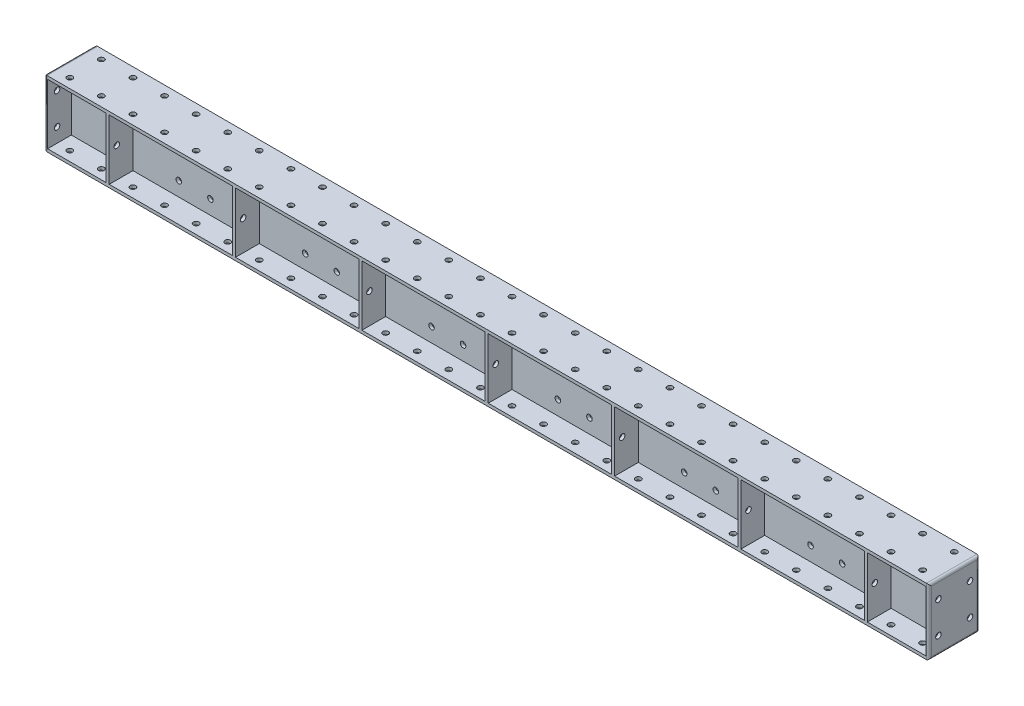
from build123d import *

# Parameters (mm, degrees)
SKETCH_1_W                         = 3500
SKETCH_1_H                         = 262
EXTRUDE_1_DEPTH                    = 200
SKETCH_5_W                         = 232
SKETCH_5_H                         = 238
SKETCH_5_W_2                       = 488
CUT_EXTRUDE_10_DEPTH               = 3516.486310598
SKETCH_7_W                         = 3500
SKETCH_7_H                         = 12
EXTRUDE_13_DEPTH                   = 260
SKETCH_8_R                         = 11
CUT_EXTRUDE_14_DEPTH               = 3516.486310598
PATTERN_LINEAR_3_COUNT             = 28
PATTERN_LINEAR_3_PITCH             = 125
PATTERN_LINEAR_3_COUNT_DIR2        = 2
PATTERN_LINEAR_3_PITCH_DIR2        = 125
SKETCH_10_R                        = 11
CUT_EXTRUDE_16_DEPTH               = 20
PATTERN_LINEAR_5_COUNT             = 2
PATTERN_LINEAR_5_PITCH             = 125
PATTERN_LINEAR_5_COUNT_DIR2        = 2
PATTERN_LINEAR_5_PITCH_DIR2        = 125
CUT_EXTRUDE_START                  = -20
SKETCH_11_R                        = 11
CUT_EXTRUDE_17_DEPTH               = 20
PATTERN_LINEAR_6_COUNT             = 2
PATTERN_LINEAR_6_PITCH             = 125
PATTERN_LINEAR_6_COUNT_DIR2        = 2
PATTERN_LINEAR_6_PITCH_DIR2        = 125
SKETCH_12_R                        = 11
CUT_EXTRUDE_18_DEPTH               = 3020
PATTERN_LINEAR_8_COUNT             = 2
PATTERN_LINEAR_8_PITCH             = 140.2426687
FILLET_1_R                         = 10
FILLET_2_R                         = 10
SKETCH_13_R                        = 11
CUT_EXTRUDE_19_DEPTH               = 3512.392886021
PATTERN_LINEAR_9_COUNT             = 2
PATTERN_LINEAR_9_PITCH             = 125
PATTERN_LINEAR_9_COUNT_DIR2        = 2
PATTERN_LINEAR_9_PITCH_DIR2        = 125
PATTERN_LINEAR_10_COUNT            = 6
PATTERN_LINEAR_10_PITCH            = 500
PATTERN_LINEAR_10_COPY_1_SKETCH_R  = 11
PATTERN_LINEAR_10_COPY_1_DEPTH     = 3512.392886021
PATTERN_LINEAR_10_COPY_2_SKETCH_R  = 11
PATTERN_LINEAR_10_COPY_2_DEPTH     = 3512.392886021
PATTERN_LINEAR_10_COPY_3_SKETCH_R  = 11
PATTERN_LINEAR_10_COPY_3_DEPTH     = 3512.392886021
PATTERN_LINEAR_10_COPY_4_SKETCH_R  = 11
PATTERN_LINEAR_10_COPY_4_DEPTH     = 3512.392886021
PATTERN_LINEAR_10_COPY_5_SKETCH_R  = 11
PATTERN_LINEAR_10_COPY_5_DEPTH     = 3512.392886021
PATTERN_LINEAR_10_COPY_6_SKETCH_R  = 11
PATTERN_LINEAR_10_COPY_6_DEPTH     = 3512.392886021
PATTERN_LINEAR_10_COPY_7_SKETCH_R  = 11
PATTERN_LINEAR_10_COPY_7_DEPTH     = 3512.392886021
PATTERN_LINEAR_10_COPY_8_SKETCH_R  = 11
PATTERN_LINEAR_10_COPY_8_DEPTH     = 3512.392886021
PATTERN_LINEAR_10_COPY_9_SKETCH_R  = 11
PATTERN_LINEAR_10_COPY_9_DEPTH     = 3512.392886021
PATTERN_LINEAR_10_COPY_10_SKETCH_R = 11
PATTERN_LINEAR_10_COPY_10_DEPTH    = 3512.392886021
PATTERN_LINEAR_10_COPY_11_SKETCH_R = 11
PATTERN_LINEAR_10_COPY_11_DEPTH    = 3512.392886021
PATTERN_LINEAR_10_COPY_12_SKETCH_R = 11
PATTERN_LINEAR_10_COPY_12_DEPTH    = 3512.392886021
PATTERN_LINEAR_10_COPY_13_SKETCH_R = 11
PATTERN_LINEAR_10_COPY_13_DEPTH    = 3512.392886021
PATTERN_LINEAR_10_COPY_14_SKETCH_R = 11
PATTERN_LINEAR_10_COPY_14_DEPTH    = 3512.392886021
PATTERN_LINEAR_10_COPY_15_SKETCH_R = 11
PATTERN_LINEAR_10_COPY_15_DEPTH    = 3512.392886021


with BuildPart() as part:
    # 草图1 → 拉伸1 (new body)
    with BuildSketch(Plane.XY):
        with Locations((1750, 131)):
            Rectangle(SKETCH_1_W, SKETCH_1_H)
    extrude(amount=EXTRUDE_1_DEPTH)

    # 草图5 → 拉伸10 (cut, through all)
    with BuildSketch(Plane.XY.offset(200)):
        with Locations((128, 131)):
            Rectangle(SKETCH_5_W, SKETCH_5_H)
        with Locations((500, 131)):
            Rectangle(SKETCH_5_W_2, SKETCH_5_H)
        with Locations((1000, 131)):
            Rectangle(SKETCH_5_W_2, SKETCH_5_H)
        with Locations((1500, 131)):
            Rectangle(SKETCH_5_W_2, SKETCH_5_H)
        with Locations((2000, 131)):
            Rectangle(SKETCH_5_W_2, SKETCH_5_H)
        with Locations((2500, 131)):
            Rectangle(SKETCH_5_W_2, SKETCH_5_H)
        with Locations((3000, 131)):
            Rectangle(SKETCH_5_W_2, SKETCH_5_H)
        with Locations((3372, 131)):
            Rectangle(SKETCH_5_W, SKETCH_5_H)
    extrude(amount=-CUT_EXTRUDE_10_DEPTH, mode=Mode.SUBTRACT)

    # 草图7 → 拉伸13 (add)
    with BuildSketch(Plane.XZ):
        with Locations((1750, 100)):
            Rectangle(SKETCH_7_W, SKETCH_7_H)
    extrude(amount=-EXTRUDE_13_DEPTH)

    # 草图8 → 拉伸14 (cut, through all)
    with BuildSketch(Plane.XZ):
        with Locations(Location((62.5, 37.5, 0), (0, 0, 270))):
            Circle(SKETCH_8_R)
    cut_extrude_14 = extrude(amount=-CUT_EXTRUDE_14_DEPTH, mode=Mode.SUBTRACT)

    # 阵列(线性)3: Cut-Extrude 14 28 × 2
    with Locations(*[(i * PATTERN_LINEAR_3_PITCH, 0, j * PATTERN_LINEAR_3_PITCH_DIR2) for i in range(PATTERN_LINEAR_3_COUNT) for j in range(PATTERN_LINEAR_3_COUNT_DIR2) if (i, j) != (0, 0)]):
        add(cut_extrude_14, mode=Mode.SUBTRACT)

    # 草图10 → 拉伸16 (cut)
    with BuildSketch(Plane.ZY):
        with Locations((37.5, 68.5)):
            Circle(SKETCH_10_R)
    cut_extrude_16 = extrude(amount=-CUT_EXTRUDE_16_DEPTH, mode=Mode.SUBTRACT)

    # 阵列(线性)5: Cut-Extrude 16 2 × 2
    with Locations(*[(0, j * PATTERN_LINEAR_5_PITCH_DIR2, i * PATTERN_LINEAR_5_PITCH) for i in range(PATTERN_LINEAR_5_COUNT) for j in range(PATTERN_LINEAR_5_COUNT_DIR2) if (i, j) != (0, 0)]):
        add(cut_extrude_16, mode=Mode.SUBTRACT)

    # 草图11 → 拉伸17 (cut)
    with BuildSketch(Plane(origin=(3500, 0, 0), x_dir=(0, 0, -1), z_dir=(1, 0, 0)).offset(CUT_EXTRUDE_START)):
        with Locations(Location((-162.5, 68.5, 0), (0, 0, 180))):
            Circle(SKETCH_11_R)
    cut_extrude_17 = extrude(amount=CUT_EXTRUDE_17_DEPTH, mode=Mode.SUBTRACT)

    # 阵列(线性)6: Cut-Extrude 17 2 × 2
    with Locations(*[(0, j * PATTERN_LINEAR_6_PITCH_DIR2, -i * PATTERN_LINEAR_6_PITCH) for i in range(PATTERN_LINEAR_6_COUNT) for j in range(PATTERN_LINEAR_6_COUNT_DIR2) if (i, j) != (0, 0)]):
        add(cut_extrude_17, mode=Mode.SUBTRACT)

    # 草图12 → 拉伸18 (cut)
    with BuildSketch(Plane(origin=(3256, 0, 0), x_dir=(0, 0, -1), z_dir=(1, 0, 0))):
        with Locations((-170.12133435, 131)):
            Circle(SKETCH_12_R)
    cut_extrude_18 = extrude(amount=-CUT_EXTRUDE_18_DEPTH, mode=Mode.SUBTRACT)

    # 阵列(线性)8: 拉伸18 ×2
    with Locations(*[(0, 0, -i * PATTERN_LINEAR_8_PITCH) for i in range(1, PATTERN_LINEAR_8_COUNT)]):
        add(cut_extrude_18, mode=Mode.SUBTRACT)

    # 圆角1
    fillet_1_edges = [part.edges().sort_by_distance(p)[0] for p in [
        (0, 131, 200),
        (0, 131, 0),
        (0, 262, 100),
        (0, 0, 100),
    ]]
    fillet(fillet_1_edges, radius=FILLET_1_R)

    # 圆角2
    fillet_2_edges = [part.edges().sort_by_distance(p)[0] for p in [
        (3500, 131, 200),
        (3500, 131, 0),
        (3500, 262, 100),
        (3500, 0, 100),
    ]]
    fillet(fillet_2_edges, radius=FILLET_2_R)

    # 草图13 → 拉伸19 (cut, through all)
    with BuildSketch(Plane.XY.offset(106)):
        with Locations((437.5, 68.5)):
            Circle(SKETCH_13_R)
    cut_extrude_19 = extrude(amount=-CUT_EXTRUDE_19_DEPTH, mode=Mode.SUBTRACT)

    # 阵列(线性)9: Cut-Extrude 19 2 × 2
    with Locations(*[(i * PATTERN_LINEAR_9_PITCH, j * PATTERN_LINEAR_9_PITCH_DIR2, 0) for i in range(PATTERN_LINEAR_9_COUNT) for j in range(PATTERN_LINEAR_9_COUNT_DIR2) if (i, j) != (0, 0)]):
        add(cut_extrude_19, mode=Mode.SUBTRACT)

    # 阵列(线性)10: 拉伸19 ×6
    with Locations(*[(i * PATTERN_LINEAR_10_PITCH, 0, 0) for i in range(1, PATTERN_LINEAR_10_COUNT)]):
        add(cut_extrude_19, mode=Mode.SUBTRACT)

    # 阵列(线性)10 copy 1 sketch → 阵列(线性)10 copy 1 (cut, through all)
    with BuildSketch(Plane(origin=(500, 125, 106), x_dir=(1, 0, 0), z_dir=(0, 0, 1))):
        with Locations((437.5, 68.5)):
            Circle(PATTERN_LINEAR_10_COPY_1_SKETCH_R)
    extrude(amount=-PATTERN_LINEAR_10_COPY_1_DEPTH, mode=Mode.SUBTRACT)

    # 阵列(线性)10 copy 2 sketch → 阵列(线性)10 copy 2 (cut, through all)
    with BuildSketch(Plane(origin=(1000, 125, 106), x_dir=(1, 0, 0), z_dir=(0, 0, 1))):
        with Locations((437.5, 68.5)):
            Circle(PATTERN_LINEAR_10_COPY_2_SKETCH_R)
    extrude(amount=-PATTERN_LINEAR_10_COPY_2_DEPTH, mode=Mode.SUBTRACT)

    # 阵列(线性)10 copy 3 sketch → 阵列(线性)10 copy 3 (cut, through all)
    with BuildSketch(Plane(origin=(1500, 125, 106), x_dir=(1, 0, 0), z_dir=(0, 0, 1))):
        with Locations((437.5, 68.5)):
            Circle(PATTERN_LINEAR_10_COPY_3_SKETCH_R)
    extrude(amount=-PATTERN_LINEAR_10_COPY_3_DEPTH, mode=Mode.SUBTRACT)

    # 阵列(线性)10 copy 4 sketch → 阵列(线性)10 copy 4 (cut, through all)
    with BuildSketch(Plane(origin=(2000, 125, 106), x_dir=(1, 0, 0), z_dir=(0, 0, 1))):
        with Locations((437.5, 68.5)):
            Circle(PATTERN_LINEAR_10_COPY_4_SKETCH_R)
    extrude(amount=-PATTERN_LINEAR_10_COPY_4_DEPTH, mode=Mode.SUBTRACT)

    # 阵列(线性)10 copy 5 sketch → 阵列(线性)10 copy 5 (cut, through all)
    with BuildSketch(Plane(origin=(2500, 125, 106), x_dir=(1, 0, 0), z_dir=(0, 0, 1))):
        with Locations((437.5, 68.5)):
            Circle(PATTERN_LINEAR_10_COPY_5_SKETCH_R)
    extrude(amount=-PATTERN_LINEAR_10_COPY_5_DEPTH, mode=Mode.SUBTRACT)

    # 阵列(线性)10 copy 6 sketch → 阵列(线性)10 copy 6 (cut, through all)
    with BuildSketch(Plane(origin=(625, 0, 106), x_dir=(1, 0, 0), z_dir=(0, 0, 1))):
        with Locations((437.5, 68.5)):
            Circle(PATTERN_LINEAR_10_COPY_6_SKETCH_R)
    extrude(amount=-PATTERN_LINEAR_10_COPY_6_DEPTH, mode=Mode.SUBTRACT)

    # 阵列(线性)10 copy 7 sketch → 阵列(线性)10 copy 7 (cut, through all)
    with BuildSketch(Plane(origin=(1125, 0, 106), x_dir=(1, 0, 0), z_dir=(0, 0, 1))):
        with Locations((437.5, 68.5)):
            Circle(PATTERN_LINEAR_10_COPY_7_SKETCH_R)
    extrude(amount=-PATTERN_LINEAR_10_COPY_7_DEPTH, mode=Mode.SUBTRACT)

    # 阵列(线性)10 copy 8 sketch → 阵列(线性)10 copy 8 (cut, through all)
    with BuildSketch(Plane(origin=(1625, 0, 106), x_dir=(1, 0, 0), z_dir=(0, 0, 1))):
        with Locations((437.5, 68.5)):
            Circle(PATTERN_LINEAR_10_COPY_8_SKETCH_R)
    extrude(amount=-PATTERN_LINEAR_10_COPY_8_DEPTH, mode=Mode.SUBTRACT)

    # 阵列(线性)10 copy 9 sketch → 阵列(线性)10 copy 9 (cut, through all)
    with BuildSketch(Plane(origin=(2125, 0, 106), x_dir=(1, 0, 0), z_dir=(0, 0, 1))):
        with Locations((437.5, 68.5)):
            Circle(PATTERN_LINEAR_10_COPY_9_SKETCH_R)
    extrude(amount=-PATTERN_LINEAR_10_COPY_9_DEPTH, mode=Mode.SUBTRACT)

    # 阵列(线性)10 copy 10 sketch → 阵列(线性)10 copy 10 (cut, through all)
    with BuildSketch(Plane(origin=(2625, 0, 106), x_dir=(1, 0, 0), z_dir=(0, 0, 1))):
        with Locations((437.5, 68.5)):
            Circle(PATTERN_LINEAR_10_COPY_10_SKETCH_R)
    extrude(amount=-PATTERN_LINEAR_10_COPY_10_DEPTH, mode=Mode.SUBTRACT)

    # 阵列(线性)10 copy 11 sketch → 阵列(线性)10 copy 11 (cut, through all)
    with BuildSketch(Plane(origin=(625, 125, 106), x_dir=(1, 0, 0), z_dir=(0, 0, 1))):
        with Locations((437.5, 68.5)):
            Circle(PATTERN_LINEAR_10_COPY_11_SKETCH_R)
    extrude(amount=-PATTERN_LINEAR_10_COPY_11_DEPTH, mode=Mode.SUBTRACT)

    # 阵列(线性)10 copy 12 sketch → 阵列(线性)10 copy 12 (cut, through all)
    with BuildSketch(Plane(origin=(1125, 125, 106), x_dir=(1, 0, 0), z_dir=(0, 0, 1))):
        with Locations((437.5, 68.5)):
            Circle(PATTERN_LINEAR_10_COPY_12_SKETCH_R)
    extrude(amount=-PATTERN_LINEAR_10_COPY_12_DEPTH, mode=Mode.SUBTRACT)

    # 阵列(线性)10 copy 13 sketch → 阵列(线性)10 copy 13 (cut, through all)
    with BuildSketch(Plane(origin=(1625, 125, 106), x_dir=(1, 0, 0), z_dir=(0, 0, 1))):
        with Locations((437.5, 68.5)):
            Circle(PATTERN_LINEAR_10_COPY_13_SKETCH_R)
    extrude(amount=-PATTERN_LINEAR_10_COPY_13_DEPTH, mode=Mode.SUBTRACT)

    # 阵列(线性)10 copy 14 sketch → 阵列(线性)10 copy 14 (cut, through all)
    with BuildSketch(Plane(origin=(2125, 125, 106), x_dir=(1, 0, 0), z_dir=(0, 0, 1))):
        with Locations((437.5, 68.5)):
            Circle(PATTERN_LINEAR_10_COPY_14_SKETCH_R)
    extrude(amount=-PATTERN_LINEAR_10_COPY_14_DEPTH, mode=Mode.SUBTRACT)

    # 阵列(线性)10 copy 15 sketch → 阵列(线性)10 copy 15 (cut, through all)
    with BuildSketch(Plane(origin=(2625, 125, 106), x_dir=(1, 0, 0), z_dir=(0, 0, 1))):
        with Locations((437.5, 68.5)):
            Circle(PATTERN_LINEAR_10_COPY_15_SKETCH_R)
    extrude(amount=-PATTERN_LINEAR_10_COPY_15_DEPTH, mode=Mode.SUBTRACT)


solid = part.part
